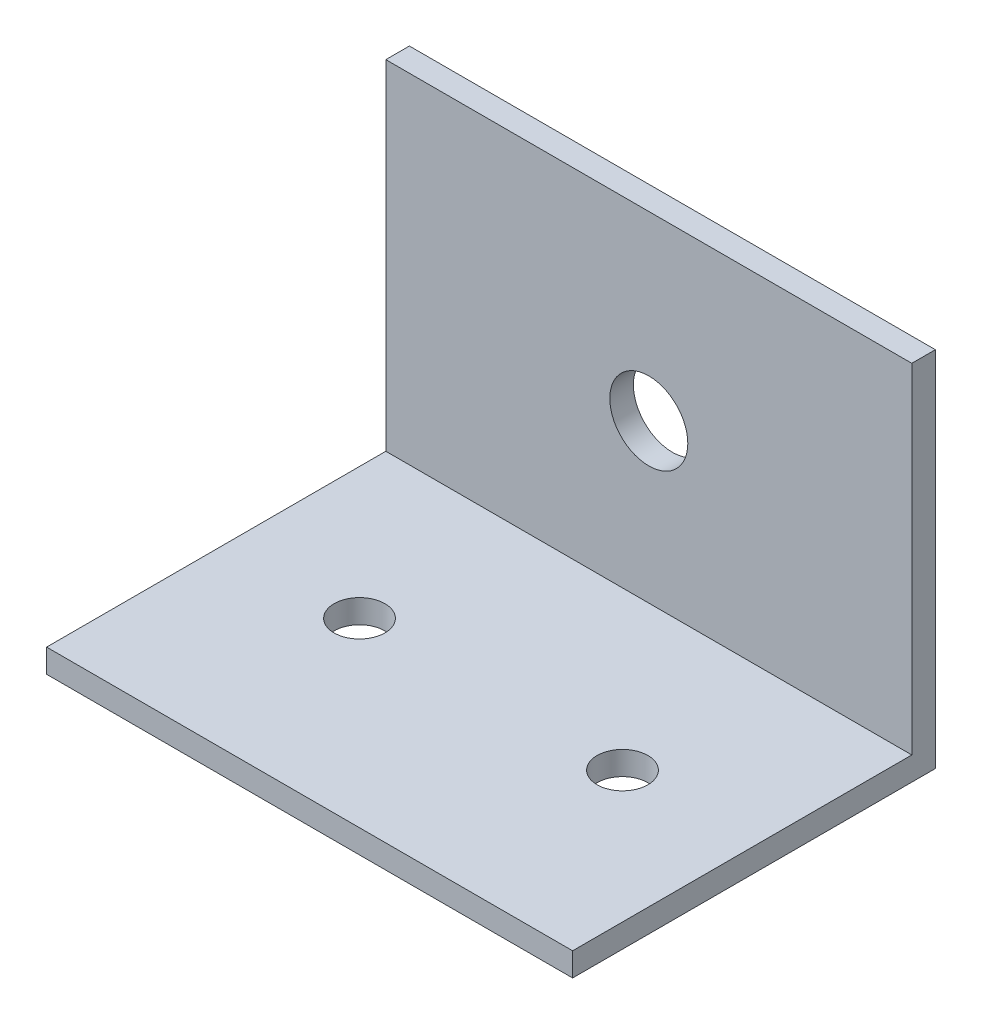
from build123d import *

# Parameters (mm, degrees)
SKETCH1_W           = 73.66
SKETCH1_H           = 50.8
BOSS_EXTRUDE2_DEPTH = 3.302
SKETCH4_W           = 73.66
SKETCH4_H           = 3.302
BOSS_EXTRUDE3_DEPTH = 47.498
SKETCH5_R           = 5.461
CUT_EXTRUDE2_DEPTH  = 68.692310494
SKETCH8_R           = 3.556
CUT_EXTRUDE3_DEPTH  = 81.732452583


with BuildPart() as part:
    # Sketch1 → Boss-Extrude2 (new body)
    with BuildSketch(Plane.XY):
        Rectangle(SKETCH1_W, SKETCH1_H)
    extrude(amount=BOSS_EXTRUDE2_DEPTH)

    # Sketch4 → Boss-Extrude3 (add)
    with BuildSketch(Plane.XY.offset(3.302)):
        with Locations((0, -23.749)):
            Rectangle(SKETCH4_W, SKETCH4_H)
    extrude(amount=BOSS_EXTRUDE3_DEPTH)

    # Sketch5 → Cut-Extrude2 (cut, through all)
    with BuildSketch(Plane(origin=(0, 0, 0), x_dir=(-1, 0, 0), z_dir=(0, 0, -1))):
        Circle(SKETCH5_R)
    extrude(amount=-CUT_EXTRUDE2_DEPTH, mode=Mode.SUBTRACT)

    # Sketch8 → Cut-Extrude3 (cut, through all)
    with BuildSketch(Plane.XZ.offset(25.4)):
        with Locations(Location((-18.415, 25.4, 0), (0, 0, 270))):
            Circle(SKETCH8_R)
        with Locations(Location((18.415, 25.4, 0), (0, 0, 270))):
            Circle(SKETCH8_R)
    extrude(amount=-CUT_EXTRUDE3_DEPTH, mode=Mode.SUBTRACT)


solid = part.part
